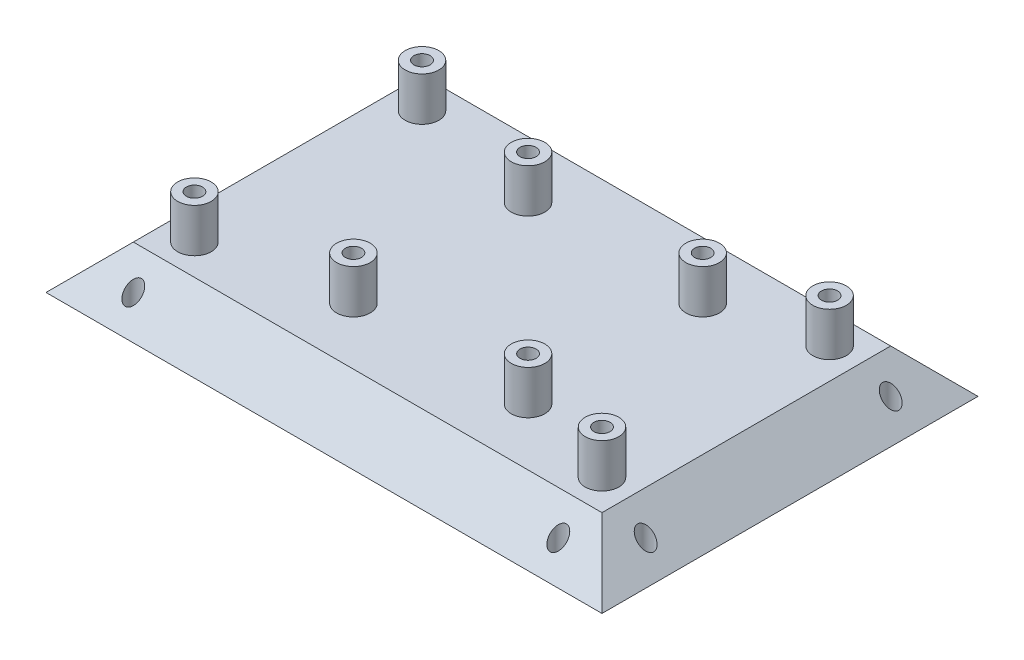
from build123d import *

# Parameters (mm, degrees)
SKETCH3_R           = 1.85
CUT_EXTRUDE1_DEPTH  = 155.06371723
SKETCH4_R           = 3.85
SKETCH4_R_2         = 1.85
BOSS_EXTRUDE1_DEPTH = 10
SKETCH_2_R          = 3.85
SKETCH_2_R_2        = 1.85
EXTRUDE_1_DEPTH     = 10


with BuildPart() as part:
    # Sketch1 → Loft1 section 0
    with BuildSketch(Plane(origin=(0, 0, 0), x_dir=(1, 0, 0), z_dir=(0, 1, 0))):
        with BuildLine():
            Line((0, 0), (127.35007717, 0))
            Line((127.35007717, 0), (127.35007717, -86.125413014))
            Line((127.35007717, -86.125413014), (0, -86.125413014))
            Line((0, -86.125413014), (0, 0))
        make_face()
    # Sketch2 → Loft1 section 1
    with BuildSketch(Plane(origin=(0, 10, 0), x_dir=(1, 0, 0), z_dir=(0, 1, 0))):
        with BuildLine():
            Line((10, -10), (10, -76.125413014))
            Line((10, -76.125413014), (117.35007717, -76.125413014))
            Line((117.35007717, -76.125413014), (117.35007717, -10))
            Line((117.35007717, -10), (10, -10))
        make_face()
    loft()

    # Sketch3 → Cut-Extrude1 (cut, through all)
    with BuildSketch(Plane.XZ):
        with Locations(Location((5, 15, 0), (0, 0, 270))):
            Circle(SKETCH3_R)
        with Locations(Location((5, 71.125413014, 0), (0, 0, 180))):
            Circle(SKETCH3_R)
        with Locations(Location((122.35007717, 71.125413014, 0), (0, 0, 270))):
            Circle(SKETCH3_R)
        with Locations((122.35007717, 15)):
            Circle(SKETCH3_R)
        with Locations(Location((15, 5, 0), (0, 0, 270))):
            Circle(SKETCH3_R)
        with Locations(Location((15, 81.125413014, 0), (0, 0, 270))):
            Circle(SKETCH3_R)
        with Locations(Location((112.35007717, 81.125413014, 0), (0, 0, 90))):
            Circle(SKETCH3_R)
        with Locations(Location((112.35007717, 5, 0), (0, 0, 270))):
            Circle(SKETCH3_R)
    extrude(amount=-CUT_EXTRUDE1_DEPTH, mode=Mode.SUBTRACT)

    # Sketch4 → Boss-Extrude1 (add)
    # profile 1 of 4: a face of its own
    with BuildSketch(Plane(origin=(0, 10, 0), x_dir=(1, 0, 0), z_dir=(0, 1, 0))):
        with Locations(Location((110.35007717, -69.125413014, 0), (0, 0, 270))):
            Circle(SKETCH4_R)
        with Locations(Location((110.35007717, -69.125413014, 0), (0, 0, 270))):
            Circle(SKETCH4_R_2, mode=Mode.SUBTRACT)
    # profile 2 of 4: a face of its own
    with BuildSketch(Plane(origin=(0, 10, 0), x_dir=(1, 0, 0), z_dir=(0, 1, 0))):
        with Locations(Location((110.35007717, -17, 0), (0, 0, 90))):
            Circle(SKETCH4_R)
        with Locations(Location((110.35007717, -17, 0), (0, 0, 90))):
            Circle(SKETCH4_R_2, mode=Mode.SUBTRACT)
    # profile 3 of 4: a face of its own
    with BuildSketch(Plane(origin=(0, 10, 0), x_dir=(1, 0, 0), z_dir=(0, 1, 0))):
        with Locations(Location((17, -17, 0), (0, 0, 270))):
            Circle(SKETCH4_R)
        with Locations(Location((17, -17, 0), (0, 0, 270))):
            Circle(SKETCH4_R_2, mode=Mode.SUBTRACT)
    # profile 4 of 4: a face of its own
    with BuildSketch(Plane(origin=(0, 10, 0), x_dir=(1, 0, 0), z_dir=(0, 1, 0))):
        with Locations(Location((17, -69.125413014, 0), (0, 0, 90))):
            Circle(SKETCH4_R)
        with Locations(Location((17, -69.125413014, 0), (0, 0, 90))):
            Circle(SKETCH4_R_2, mode=Mode.SUBTRACT)
    extrude(amount=BOSS_EXTRUDE1_DEPTH)

    # Эскиз2 → Бобышка-Вытянуть1 (add)
    # profile 1 of 4: a face of its own
    with BuildSketch(Plane(origin=(0, 10, 0), x_dir=(1, 0, 0), z_dir=(0, 1, 0))):
        with Locations(Location((87.35007717, -23.062706507, 0), (0, 0, 270))):
            Circle(SKETCH_2_R)
        with Locations(Location((87.35007717, -23.062706507, 0), (0, 0, 270))):
            Circle(SKETCH_2_R_2, mode=Mode.SUBTRACT)
    # profile 2 of 4: a face of its own
    with BuildSketch(Plane(origin=(0, 10, 0), x_dir=(1, 0, 0), z_dir=(0, 1, 0))):
        with Locations(Location((47.35007717, -23.062706507, 0), (0, 0, 270))):
            Circle(SKETCH_2_R)
        with Locations(Location((47.35007717, -23.062706507, 0), (0, 0, 270))):
            Circle(SKETCH_2_R_2, mode=Mode.SUBTRACT)
    # profile 3 of 4: a face of its own
    with BuildSketch(Plane(origin=(0, 10, 0), x_dir=(1, 0, 0), z_dir=(0, 1, 0))):
        with Locations(Location((47.35007717, -63.062706507, 0), (0, 0, 270))):
            Circle(SKETCH_2_R)
        with Locations(Location((47.35007717, -63.062706507, 0), (0, 0, 270))):
            Circle(SKETCH_2_R_2, mode=Mode.SUBTRACT)
    # profile 4 of 4: a face of its own
    with BuildSketch(Plane(origin=(0, 10, 0), x_dir=(1, 0, 0), z_dir=(0, 1, 0))):
        with Locations(Location((87.35007717, -63.062706507, 0), (0, 0, 270))):
            Circle(SKETCH_2_R)
        with Locations(Location((87.35007717, -63.062706507, 0), (0, 0, 270))):
            Circle(SKETCH_2_R_2, mode=Mode.SUBTRACT)
    extrude(amount=EXTRUDE_1_DEPTH)


solid = part.part
